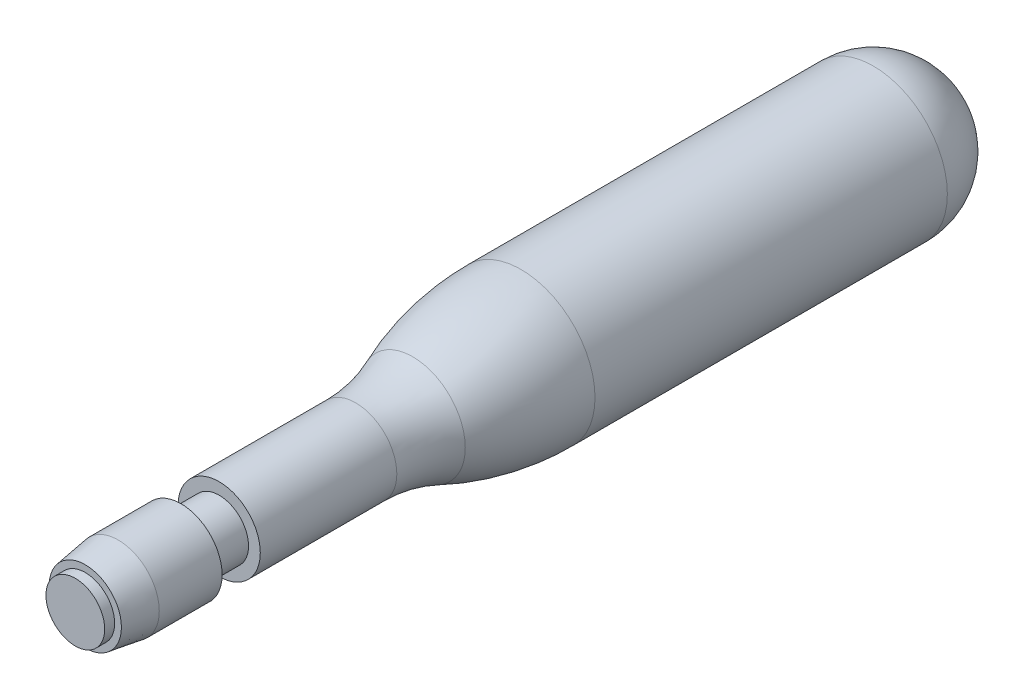
from build123d import *


with BuildPart() as part:
    # Sketch1 → Revolve1 (revolve)
    with BuildSketch(Plane(origin=(0, 0, 0), x_dir=(1, 0, 0), z_dir=(0, 1, 0))):
        with BuildLine():
            Line((0, 0), (0, 148.5))
            ThreePointArc((0, 148.5), (8.909545443, 144.809545443), (12.6, 135.9))
            Line((12.6, 135.9), (12.6, 75.9))
            ThreePointArc((12.6, 75.9), (11.674574623, 66.505013574), (8.93386968, 57.471148483))
            ThreePointArc((8.93386968, 57.471148483), (7.488158337, 52.705819301), (7, 47.75))
            Line((7, 47.75), (7, 24.5))
            Line((7, 24.5), (5, 24.5))
            Line((5, 24.5), (5, 18))
            Line((5, 18), (7, 18))
            Line((7, 18), (7, 7.3))
            Line((7, 7.3), (6.15, 1.7))
            Line((6.15, 1.7), (5, 1.7))
            Line((5, 1.7), (5, 0))
            Line((5, 0), (0, 0))
        make_face()
    revolve(axis=Axis((0, 0, 0), (0, 0, -1)))


solid = part.part
